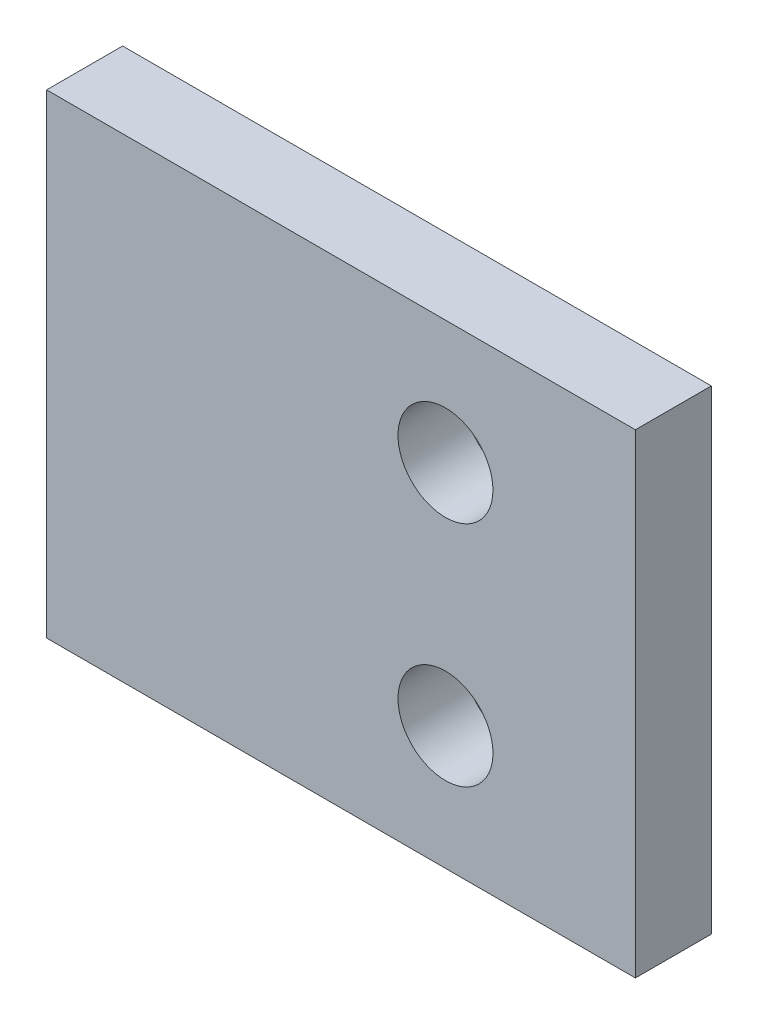
from build123d import *

# Parameters (mm, degrees)
SKETCH1_W               = 40
SKETCH1_H               = 25
BOSS_EXTRUDE1_DEPTH     = 4
SKETCH7_W               = 9
SKETCH7_H               = 25
CUT_EXTRUDE5_DEPTH      = 21
SKETCH8_W               = 20
SKETCH8_H               = 25
BOSS_EXTRUDE2_DEPTH     = 4
CUT_EXTRUDE6_DEPTH      = 43.09809972
CUT_EXTRUDE6_DEPTH_BACK = 43.09809972
SKETCH9_R               = 2.5
CUT_EXTRUDE7_DEPTH      = 0.5
FILLET1_R               = 1
SKETCH11_W              = 20
SKETCH11_H              = 25
CUT_EXTRUDE8_DEPTH      = 10


with BuildPart() as part:
    # Sketch1 → Boss-Extrude1 (new body)
    with BuildSketch(Plane.XY):
        Rectangle(SKETCH1_W, SKETCH1_H)
    extrude(amount=BOSS_EXTRUDE1_DEPTH)

    # Sketch7 → Cut-Extrude5 (cut)
    with BuildSketch(Plane.XY):
        with Locations((-15.5, 0)):
            Rectangle(SKETCH7_W, SKETCH7_H)
    extrude(amount=CUT_EXTRUDE5_DEPTH, mode=Mode.SUBTRACT)

    # Sketch8 → Boss-Extrude2 (add)
    with BuildSketch(Plane.XY):
        with Locations((30, 0)):
            Rectangle(SKETCH8_W, SKETCH8_H)
    extrude(amount=BOSS_EXTRUDE2_DEPTH)

    # Sketch9 → Cut-Extrude6 (cut, two sides: drawn at the far end of the back side and taken through both)
    with BuildSketch(Plane.XY.offset(-CUT_EXTRUDE6_DEPTH_BACK)):
        with Locations(Location((30, 6, 0), (0, 0, 180))):
            Circle(SKETCH9_R)
        with Locations(Location((30, -6, 0), (0, 0, 180))):
            Circle(SKETCH9_R)
    extrude(amount=CUT_EXTRUDE6_DEPTH + CUT_EXTRUDE6_DEPTH_BACK, mode=Mode.SUBTRACT)

    # Sketch10 → Cut-Extrude7 (cut)
    with BuildSketch(Plane.XY):
        with BuildLine():
            Line((32.705156976, 0.644430401), (32.705156976, -0.644430401))
            ThreePointArc((32.705156976, -0.644430401), (29.983190138, -11.999976452), (27.324894168, -0.629356762))
            Line((27.324894168, -0.629356762), (27.324894168, 0.629356762))
            ThreePointArc((27.324894168, 0.629356762), (29.983190138, 11.999976452), (32.705156976, 0.644430401))
        make_face()
    extrude(amount=CUT_EXTRUDE7_DEPTH, mode=Mode.SUBTRACT)

    # Fillet1
    fillet1_edges = [part.edges().sort_by_distance(p)[0] for p in [
        (27.324894168, 0.629356762, 0.25),
        (27.324894168, -0.629356762, 0.25),
        (32.705156976, -0.644430401, 0.25),
        (32.705156976, 0.644430401, 0.25),
    ]]
    fillet(fillet1_edges, radius=FILLET1_R)

    # Sketch11 → Cut-Extrude8 (cut)
    with BuildSketch(Plane.XY):
        with Locations((-1, 0)):
            Rectangle(SKETCH11_W, SKETCH11_H)
    extrude(amount=CUT_EXTRUDE8_DEPTH, mode=Mode.SUBTRACT)


solid = part.part
